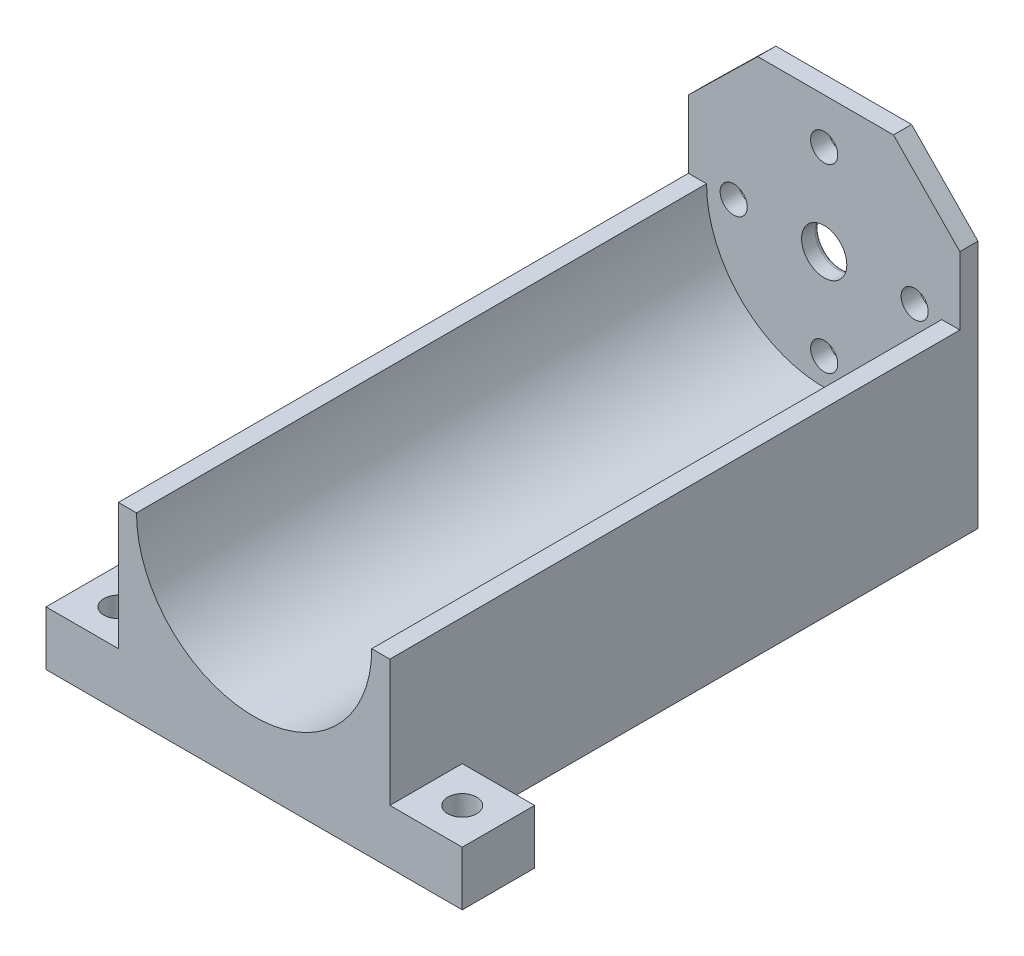
from build123d import *

# Parameters (mm, degrees)
ESQUISSE1_R        = 1.5
ESQUISSE1_R_2      = 2.5
BOSS_EXTRU_1_DEPTH = 2
BOSS_EXTRU_2_DEPTH = 65
CONG_1_R           = 0.5
ESQUISSE3_W        = 8
ESQUISSE3_H        = 8
ESQUISSE3_R        = 1.6
BOSS_EXTRU_4_DEPTH = 6


with BuildPart() as part:
    # Esquisse1 → Boss.-Extru.1 (new body)
    with BuildSketch(Plane.XY):
        with BuildLine():
            Line((-7.341000528, 15), (-15, 7.5))
            Line((-15, 7.5), (-15, 0))
            Line((-15, 0), (-13, 0))
            ThreePointArc((-13, 0), (0, -13), (13, 0))
            Line((13, 0), (15, 0))
            Line((15, 0), (15, 7.5))
            Line((15, 7.5), (7.658999472, 15))
            Line((7.658999472, 15), (-7.341000528, 15))
        make_face()
        with Locations((0, 10)):
            Circle(ESQUISSE1_R, mode=Mode.SUBTRACT)
        with Locations((-10, 0)):
            Circle(ESQUISSE1_R, mode=Mode.SUBTRACT)
        with Locations((0, -10)):
            Circle(ESQUISSE1_R, mode=Mode.SUBTRACT)
        Circle(ESQUISSE1_R_2, mode=Mode.SUBTRACT)
        with Locations((10, 0)):
            Circle(ESQUISSE1_R, mode=Mode.SUBTRACT)
    extrude(amount=BOSS_EXTRU_1_DEPTH)

    # Esquisse2 → Boss.-Extru.2 (add)
    with BuildSketch(Plane(origin=(0, 0, 0), x_dir=(-1, 0, 0), z_dir=(0, 0, -1))):
        with BuildLine():
            ThreePointArc((13, 0), (9.192388155, -9.192388155), (0, -13))
            Line((0, -13), (0, -15))
            ThreePointArc((0, -15), (10.606601718, -10.606601718), (15, 0))
            Line((15, 0), (13, 0))
        make_face()
        with BuildLine():
            Line((0, -15), (0, -13))
            ThreePointArc((0, -13), (-9.192388155, -9.192388155), (-13, 0))
            Line((-13, 0), (-15, 0))
            ThreePointArc((-15, 0), (-10.606601718, -10.606601718), (0, -15))
        make_face()
        with BuildLine():
            Line((0, -20), (0, -15))
            ThreePointArc((0, -15), (-10.606601718, -10.606601718), (-15, 0))
            Line((-15, 0), (-15, -20))
            Line((-15, -20), (0, -20))
        make_face()
        with BuildLine():
            ThreePointArc((15, 0), (10.606601718, -10.606601718), (0, -15))
            Line((0, -15), (0, -20))
            Line((0, -20), (15, -20))
            Line((15, -20), (15, 0))
        make_face()
    extrude(amount=-BOSS_EXTRU_2_DEPTH)

    # Congé1
    cong_1_edges = [part.edges().sort_by_distance(p)[0] for p in [
        (-2.5, 0, 0),
    ]]
    fillet(cong_1_edges, radius=CONG_1_R)

    # Esquisse3 → Boss.-Extru.4 (add)
    # profile 1 of 4: a face of its own
    with BuildSketch(Plane.XZ.offset(20)):
        with Locations((-19, 4)):
            Rectangle(ESQUISSE3_W, ESQUISSE3_H)
        with Locations(Location((-19, 4, 0), (0, 0, 270))):
            Circle(ESQUISSE3_R, mode=Mode.SUBTRACT)
    # profile 2 of 4: a face of its own
    with BuildSketch(Plane.XZ.offset(20)):
        with Locations((-19, 12)):
            Rectangle(ESQUISSE3_W, ESQUISSE3_H)
        with Locations(Location((-19, 12, 0), (0, 0, 270))):
            Circle(ESQUISSE3_R, mode=Mode.SUBTRACT)
    # profile 3 of 4: a face of its own
    with BuildSketch(Plane.XZ.offset(20)):
        with Locations((-19, 61)):
            Rectangle(ESQUISSE3_W, ESQUISSE3_H)
        with Locations(Location((-19, 61, 0), (0, 0, 270))):
            Circle(ESQUISSE3_R, mode=Mode.SUBTRACT)
    # profile 4 of 4: a face of its own
    with BuildSketch(Plane.XZ.offset(20)):
        with Locations((19, 61)):
            Rectangle(ESQUISSE3_W, ESQUISSE3_H)
        with Locations(Location((19, 61, 0), (0, 0, 270))):
            Circle(ESQUISSE3_R, mode=Mode.SUBTRACT)
    extrude(amount=-BOSS_EXTRU_4_DEPTH)


solid = part.part
